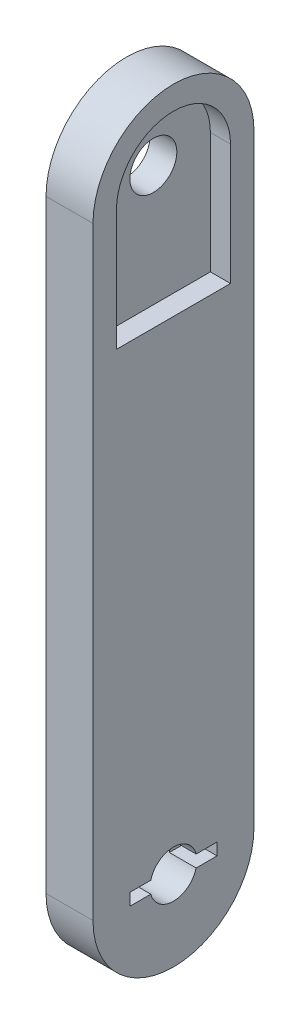
from build123d import *

# Parameters (mm, degrees)
SKETCH1_R           = 3.5
BOSS_EXTRUDE1_DEPTH = 7
CUT_EXTRUDE1_DEPTH  = 3
SKETCH3_W           = 13
SKETCH3_H           = 1.8
CUT_EXTRUDE2_DEPTH  = 4


with BuildPart() as part:
    # Sketch1 → Boss-Extrude1 (new body)
    with BuildSketch(Plane(origin=(0, 0, 0), x_dir=(0, 0, -1), z_dir=(1, 0, 0))):
        with BuildLine():
            Line((-12, 45), (-12, -45))
            ThreePointArc((-12, -45), (0, -57), (12, -45))
            Line((12, -45), (12, 45))
            ThreePointArc((12, 45), (0, 57), (-12, 45))
        make_face()
        with Locations((0, 45)):
            Circle(SKETCH1_R, mode=Mode.SUBTRACT)
        with Locations((0, -45)):
            Circle(SKETCH1_R, mode=Mode.SUBTRACT)
    extrude(amount=BOSS_EXTRUDE1_DEPTH)

    # Sketch2 → Cut-Extrude1 (cut)
    with BuildSketch(Plane(origin=(7, 0, 0), x_dir=(0, 0, -1), z_dir=(1, 0, 0))):
        with BuildLine():
            Line((-8.5, 45), (-8.5, 27))
            Line((-8.5, 27), (8.5, 27))
            Line((8.5, 27), (8.5, 45))
            ThreePointArc((8.5, 45), (0, 53.5), (-8.5, 45))
        make_face()
    extrude(amount=-CUT_EXTRUDE1_DEPTH, mode=Mode.SUBTRACT)

    # Sketch3 → Cut-Extrude2 (cut)
    with BuildSketch(Plane(origin=(7, 0, 0), x_dir=(0, 0, -1), z_dir=(1, 0, 0))):
        with Locations((0, -45)):
            Rectangle(SKETCH3_W, SKETCH3_H)
    extrude(amount=-CUT_EXTRUDE2_DEPTH, mode=Mode.SUBTRACT)


solid = part.part
